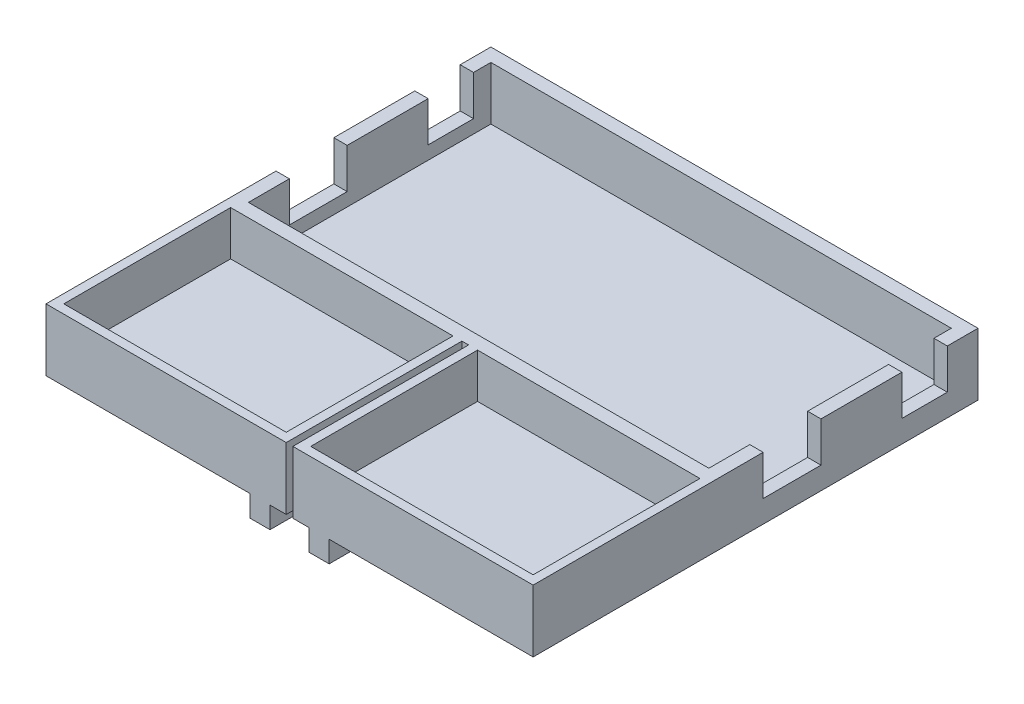
from build123d import *

# Parameters (mm, degrees)
SKETCH1_W           = 109.5
SKETCH1_H           = 60.5
BOSS_EXTRUDE1_DEPTH = 14
SKETCH2_W           = 103.5
SKETCH2_H           = 54.5
CUT_EXTRUDE1_DEPTH  = 12
SKETCH4_W           = 13
SKETCH4_H           = 9
SKETCH4_W_2         = 10.2
CUT_EXTRUDE2_DEPTH  = 115.460964962
SKETCH5_W           = 4.5
SKETCH5_H           = 100
BOSS_EXTRUDE3_DEPTH = 4.8
BOSS_EXTRUDE7_DEPTH = 14
SKETCH9_W           = 50
SKETCH9_H           = 37.5
BOSS_EXTRUDE8_DEPTH = 4


with BuildPart() as part:
    # Sketch1 → Boss-Extrude1 (new body)
    with BuildSketch(Plane(origin=(0, 0, 0), x_dir=(1, 0, 0), z_dir=(0, 1, 0))):
        Rectangle(SKETCH1_W, SKETCH1_H)
    extrude(amount=BOSS_EXTRUDE1_DEPTH)

    # Sketch2 → Cut-Extrude1 (cut)
    with BuildSketch(Plane(origin=(0, 14, 0), x_dir=(1, 0, 0), z_dir=(0, 1, 0))):
        Rectangle(SKETCH2_W, SKETCH2_H)
    extrude(amount=-CUT_EXTRUDE1_DEPTH, mode=Mode.SUBTRACT)

    # Sketch4 → Cut-Extrude2 (cut, through all)
    with BuildSketch(Plane(origin=(54.75, 0, 0), x_dir=(0, 0, -1), z_dir=(1, 0, 0))):
        with Locations((-11.55, 9.5)):
            Rectangle(SKETCH4_W, SKETCH4_H)
        with Locations((18.25, 9.5)):
            Rectangle(SKETCH4_W_2, SKETCH4_H)
    extrude(amount=-CUT_EXTRUDE2_DEPTH, mode=Mode.SUBTRACT)

    # Sketch5 → Boss-Extrude3 (add)
    with BuildSketch(Plane.XZ):
        with Locations((-6.65, 19.75)):
            Rectangle(SKETCH5_W, SKETCH5_H)
    boss_extrude3 = extrude(amount=BOSS_EXTRUDE3_DEPTH)

    # Mirror1: Boss-Extrude3 across plane
    add(boss_extrude3.mirror(Plane(origin=(0, 0, 0), x_dir=(0, 0, 1), z_dir=(1, 0, 0))))

    # Sketch6 → Boss-Extrude7 (add)
    with BuildSketch(Plane(origin=(0, 0, 0), x_dir=(1, 0, 0), z_dir=(0, 1, 0))):
        Polygon((-0.75, -30.25), (-0.75, -69.75), (-54.75, -69.75), (-54.75, -30.25), (-52.75, -30.25), (-52.75, -67.75), (-2.75, -67.75), (-2.75, -30.25), align=None)
        Polygon((54.75, -30.25), (54.75, -69.75), (0.75, -69.75), (0.75, -30.25), (2.75, -30.25), (2.75, -67.75), (52.75, -67.75), (52.75, -30.25), align=None)
    extrude(amount=BOSS_EXTRUDE7_DEPTH)

    # Sketch9 → Boss-Extrude8 (add)
    with BuildSketch(Plane(origin=(0, 0, 0), x_dir=(1, 0, 0), z_dir=(0, 1, 0))):
        with Locations((-27.75, -49)):
            Rectangle(SKETCH9_W, SKETCH9_H)
        with Locations((27.75, -49)):
            Rectangle(SKETCH9_W, SKETCH9_H)
    extrude(amount=BOSS_EXTRUDE8_DEPTH)


solid = part.part
